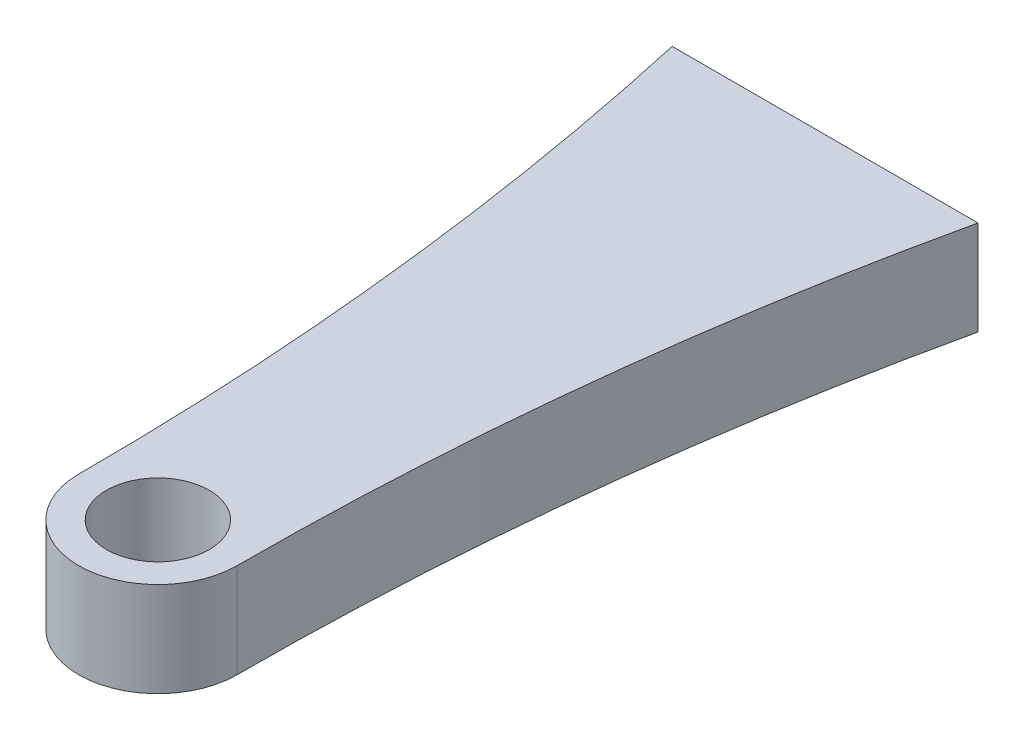
from build123d import *

# Parameters (mm, degrees)
SKETCH1_R           = 11.7475
BOSS_EXTRUDE1_DEPTH = 10.795


with BuildPart() as part:
    # Sketch1 → Boss-Extrude1 (new, symmetric)
    with BuildSketch(Plane(origin=(0, 0, 0), x_dir=(1, 0, 0), z_dir=(0, 1, 0))):
        with BuildLine():
            Line((-34.925, 152.4), (34.925, 152.4))
            ThreePointArc((34.925, 152.4), (22.317119813, 76.663101875), (18.0975, 0))
            ThreePointArc((18.0975, 0), (0, -18.0975), (-18.0975, 0))
            ThreePointArc((-18.0975, 0), (-22.317119813, 76.663101875), (-34.925, 152.4))
        make_face()
        with Locations(Location((0, 0, 0), (0, 0, 270))):
            Circle(SKETCH1_R, mode=Mode.SUBTRACT)
    extrude(amount=BOSS_EXTRUDE1_DEPTH, both=True)


solid = part.part
